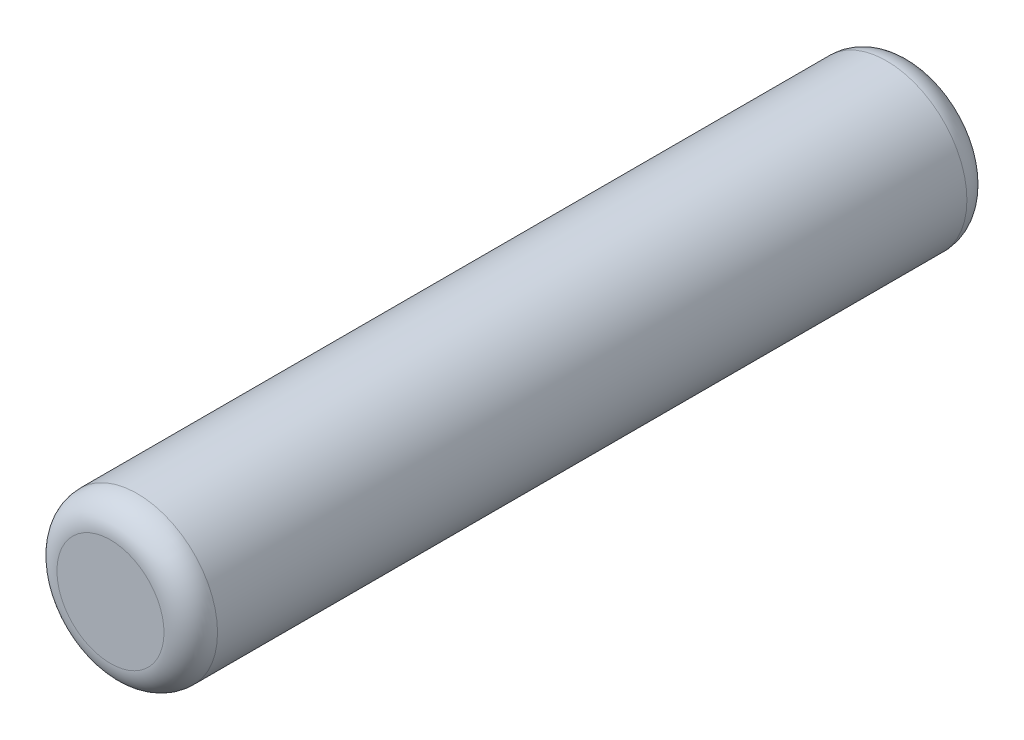
from build123d import *

# Parameters (mm, degrees)
SZKIC1_R                    = 0.6
DODANIE_WYCI_GNI_CIE1_DEPTH = 3
ZAOKR_GLENIE1_R             = 0.2


with BuildPart() as part:
    # Szkic1 → Dodanie-wyciągnięcie1 (new, symmetric)
    with BuildSketch(Plane.XY):
        Circle(SZKIC1_R)
    extrude(amount=DODANIE_WYCI_GNI_CIE1_DEPTH, both=True)

    # Zaokrąglenie1
    zaokr_glenie1_edges = [part.edges().sort_by_distance(p)[0] for p in [
        (-0.6, 0, -3),
        (-0.6, 0, 3),
    ]]
    fillet(zaokr_glenie1_edges, radius=ZAOKR_GLENIE1_R)


solid = part.part
